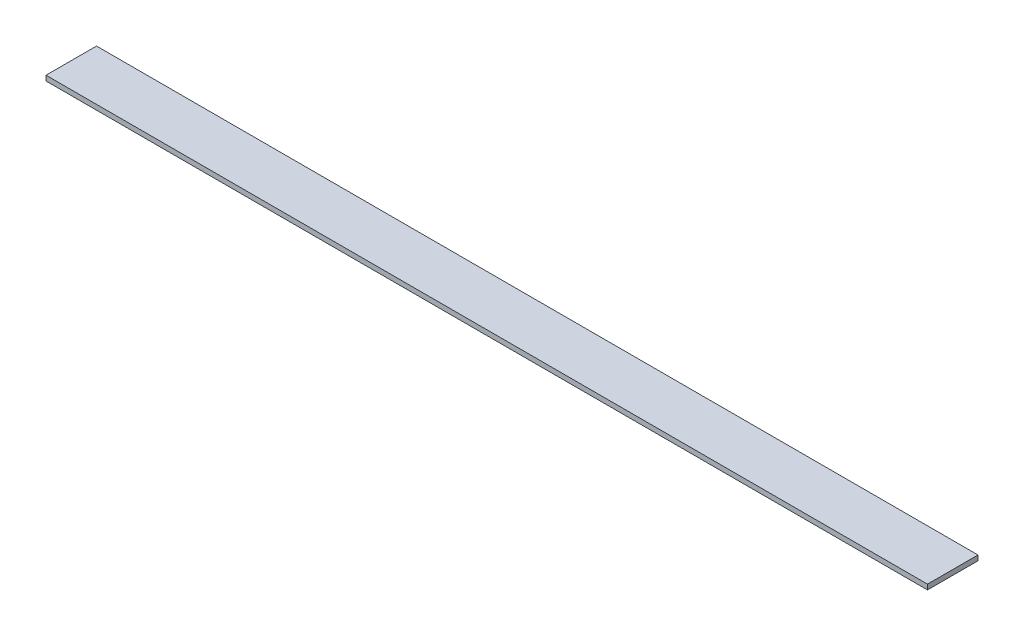
from build123d import *

# Parameters (mm, degrees)
SKETCH1_W           = 25.4
SKETCH1_H           = 2.54
BOSS_EXTRUDE1_DEPTH = 443.23


with BuildPart() as part:
    # Sketch1 → Boss-Extrude1 (new body)
    with BuildSketch(Plane(origin=(0, 0, 0), x_dir=(0, 0, -1), z_dir=(1, 0, 0))):
        with Locations((12.7, 1.27)):
            Rectangle(SKETCH1_W, SKETCH1_H)
    extrude(amount=BOSS_EXTRUDE1_DEPTH)


solid = part.part
